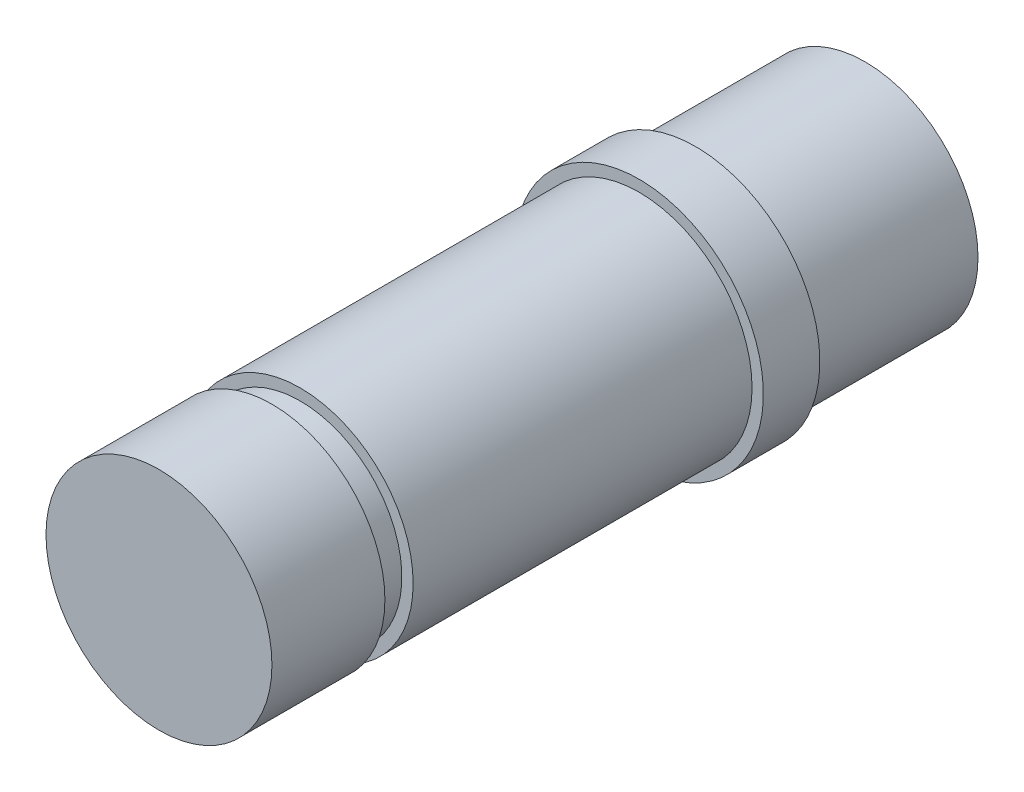
from build123d import *

# Parameters (mm, degrees)
SKETCH_1_R      = 20
EXTRUDE_1_DEPTH = 20
SKETCH_2_R      = 18
EXTRUDE_2_DEPTH = 5
EXTRUDE_START   = 60
SKETCH_3_R      = 20
EXTRUDE_3_DEPTH = 60
SKETCH_4_R      = 22
EXTRUDE_4_DEPTH = 10
EXTRUDE_START_2 = 30
SKETCH_5_R      = 20
EXTRUDE_5_DEPTH = 30


with BuildPart() as part:
    # 草图1 → 凸台-拉伸1 (new body)
    with BuildSketch(Plane.XY):
        Circle(SKETCH_1_R)
    extrude(amount=EXTRUDE_1_DEPTH)

    # 草图2 → 凸台-拉伸2 (add)
    with BuildSketch(Plane(origin=(0, 0, 0), x_dir=(-1, 0, 0), z_dir=(0, 0, -1))):
        Circle(SKETCH_2_R)
    extrude(amount=EXTRUDE_2_DEPTH)

    # 草图3 → 凸台-拉伸3 (add)
    with BuildSketch(Plane(origin=(0, 0, -5), x_dir=(-1, 0, 0), z_dir=(0, 0, -1)).offset(EXTRUDE_START)):
        with Locations(Location((0, 0, 0), (0, 0, 180))):
            Circle(SKETCH_3_R)
    extrude(amount=-EXTRUDE_3_DEPTH)

    # 草图4 → 凸台-拉伸4 (add)
    with BuildSketch(Plane(origin=(0, 0, -65), x_dir=(-1, 0, 0), z_dir=(0, 0, -1))):
        Circle(SKETCH_4_R)
    extrude(amount=EXTRUDE_4_DEPTH)

    # 草图5 → 凸台-拉伸5 (add)
    with BuildSketch(Plane(origin=(0, 0, -75), x_dir=(-1, 0, 0), z_dir=(0, 0, -1)).offset(EXTRUDE_START_2)):
        with Locations(Location((0, 0, 0), (0, 0, 180))):
            Circle(SKETCH_5_R)
    extrude(amount=-EXTRUDE_5_DEPTH)


solid = part.part
